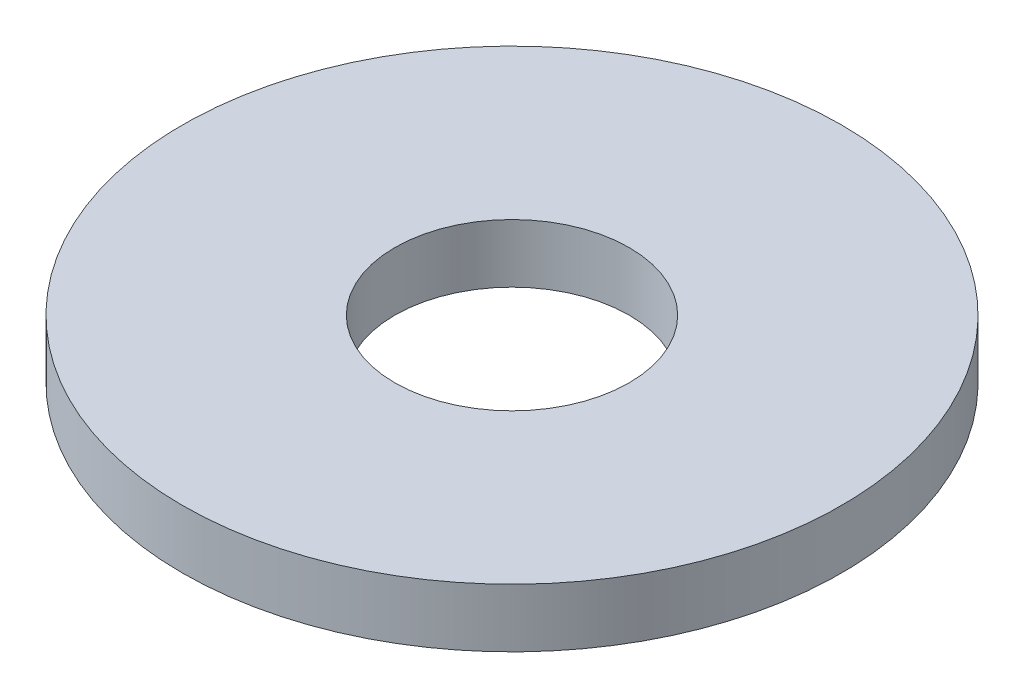
from build123d import *

# Parameters (mm, degrees)
SKETCH_1_R      = 9
SKETCH_1_R_2    = 3.2
EXTRUDE_1_DEPTH = 1.6


with BuildPart() as part:
    # Эскиз1 → Вытянуть1 (new body)
    with BuildSketch(Plane(origin=(0, 0, 0), x_dir=(1, 0, 0), z_dir=(0, 1, 0))):
        with Locations(Location((0, 0, 0), (0, 0, 270))):
            Circle(SKETCH_1_R)
        with Locations(Location((0, 0, 0), (0, 0, 270))):
            Circle(SKETCH_1_R_2, mode=Mode.SUBTRACT)
    extrude(amount=EXTRUDE_1_DEPTH)


solid = part.part
